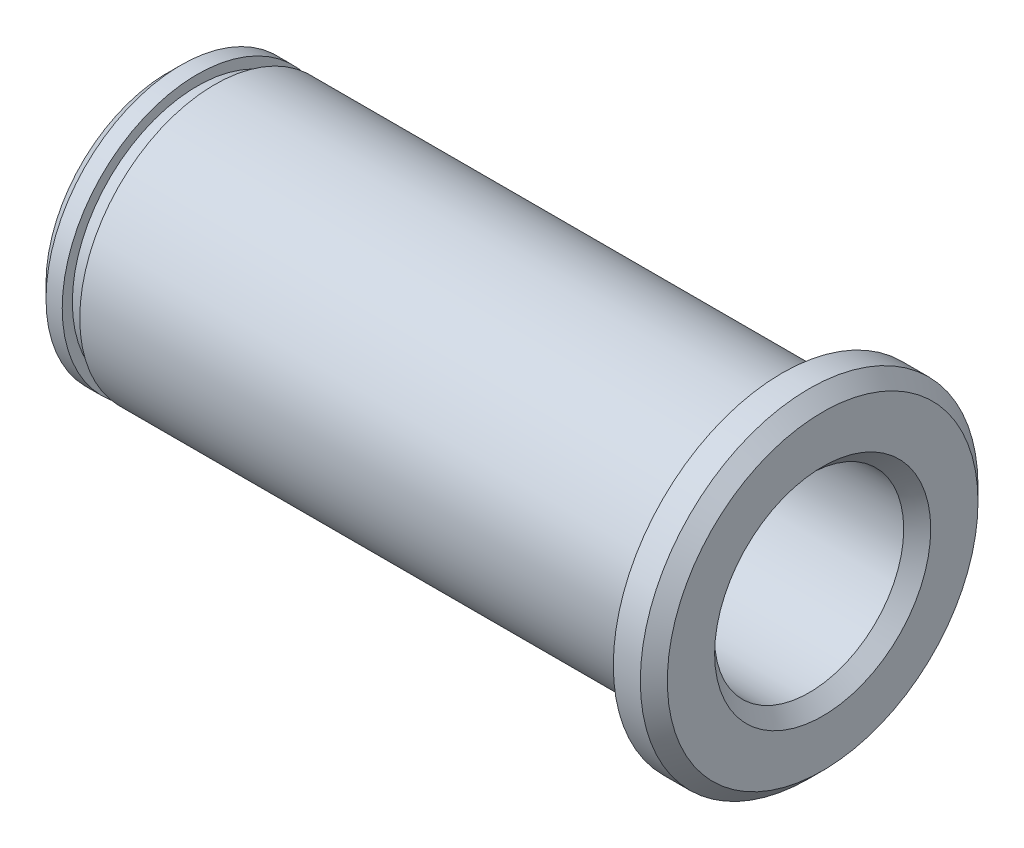
from build123d import *

# Parameters (mm, degrees)
CHAMFER1_SIZE = 1
FILLET1_R     = 0.5


with BuildPart() as part:
    # Sketch1 → Revolve1 (revolve)
    with BuildSketch(Plane.XY, mode=Mode.PRIVATE) as revolve1_sk:
        Polygon((0, -7), (48.5, -7), (48.5, -12.5), (45.5, -12.5), (45.5, -10), (3.5, -10), (3.5, -9.25), (2.2, -9.25), (2.2, -10), (0, -10), align=None)
    revolve(revolve1_sk.sketch.rotate(Axis((0, 0, 0), (1, 0, 0)), 270), axis=Axis((0, 0, 0), (1, 0, 0)))

    # Chamfer1
    chamfer1_edges = [part.edges().sort_by_distance(p)[0] for p in [
        (48.5, 0, -12.5),
        (48.5, 0, -7),
        (0, 0, -7),
        (0, 0, -10),
    ]]
    chamfer(chamfer1_edges, length=CHAMFER1_SIZE)

    # Fillet1
    fillet1_edges = [part.edges().sort_by_distance(p)[0] for p in [
        (45.5, 0, -10),
    ]]
    fillet(fillet1_edges, radius=FILLET1_R)


solid = part.part
